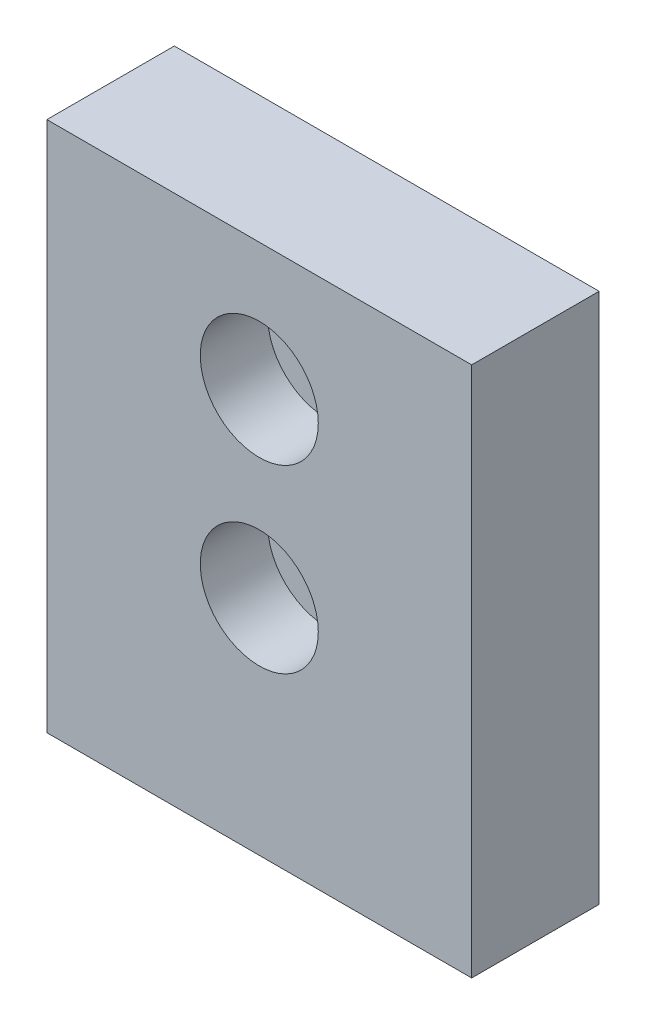
from build123d import *

# Parameters (mm, degrees)
SKETCH1_W                                        = 40
SKETCH1_H                                        = 50
BOSS_EXTRUDE1_DEPTH                              = 12
CBORE_FOR_1_4_SOCKET_HEAD_CAP_SCREW1_D           = 6.7564
CBORE_FOR_1_4_SOCKET_HEAD_CAP_SCREW1_CBORE_D     = 11.1125
CBORE_FOR_1_4_SOCKET_HEAD_CAP_SCREW1_CBORE_DEPTH = 6.35
F_8_32_TAPPED_HOLE1_D                            = 3.4544
F_8_32_TAPPED_HOLE1_DEPTH                        = 12.7
F_8_32_TAPPED_HOLE1_TIP                          = 1.037806461


with BuildPart() as part:
    # Sketch1 → Boss-Extrude1 (new body)
    with BuildSketch(Plane.XY):
        with Locations((0, 25)):
            Rectangle(SKETCH1_W, SKETCH1_H)
    extrude(amount=BOSS_EXTRUDE1_DEPTH)

    # CBORE for 1/4 Socket Head Cap Screw1 (through all)
    with Locations(Plane.XY.offset(12)):
        with Locations((0, 38), (0, 21)):
            CounterBoreHole(CBORE_FOR_1_4_SOCKET_HEAD_CAP_SCREW1_D / 2, CBORE_FOR_1_4_SOCKET_HEAD_CAP_SCREW1_CBORE_D / 2, CBORE_FOR_1_4_SOCKET_HEAD_CAP_SCREW1_CBORE_DEPTH)

    # #8-32 Tapped Hole1
    with Locations(Plane(origin=(0, 0, 0), x_dir=(-1, 0, 0), z_dir=(0, -1, 0))):
        with Locations((14, -6), (-14, -6), (0, -6)):
            Hole(F_8_32_TAPPED_HOLE1_D / 2, depth=F_8_32_TAPPED_HOLE1_DEPTH)
            with Locations((0, 0, -(F_8_32_TAPPED_HOLE1_DEPTH + F_8_32_TAPPED_HOLE1_TIP / 2))):  # 118° drill point
                Cone(0, F_8_32_TAPPED_HOLE1_D / 2, F_8_32_TAPPED_HOLE1_TIP, mode=Mode.SUBTRACT)


solid = part.part
